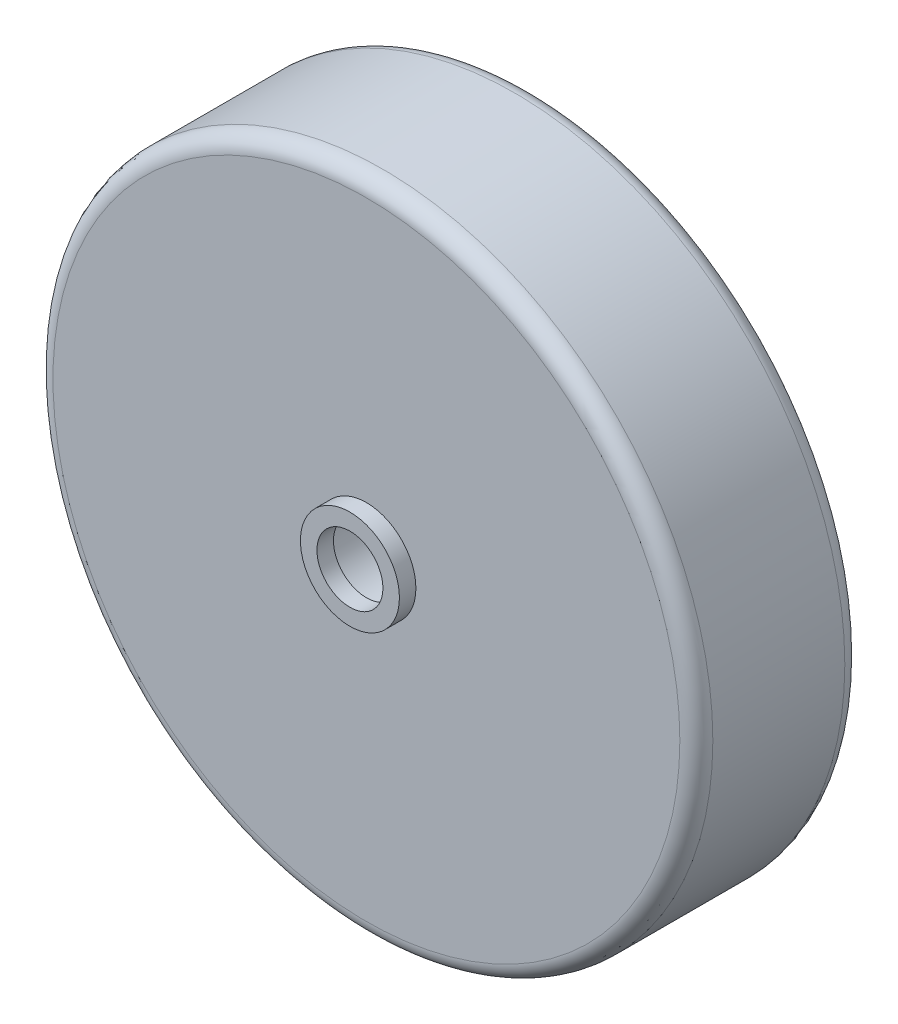
from build123d import *

# Parameters (mm, degrees)
SKETCH1_R           = 100
SKETCH1_R_2         = 15
BOSS_EXTRUDE1_DEPTH = 50
FILLET1_R           = 5
SKETCH1_5_R         = 15
SKETCH1_5_R_2       = 10
BOSS_EXTRUDE2_DEPTH = 5
BOSS_EXTRUDE3_START = 50
SKETCH1_6_R         = 15
SKETCH1_6_R_2       = 10
BOSS_EXTRUDE3_DEPTH = 5


with BuildPart() as part:
    # Sketch1 → Boss-Extrude1 (new body)
    with BuildSketch(Plane.XY):
        Circle(SKETCH1_R)
        Circle(SKETCH1_R_2, mode=Mode.SUBTRACT)
    extrude(amount=BOSS_EXTRUDE1_DEPTH)

    # Fillet1
    fillet1_edges = [part.edges().sort_by_distance(p)[0] for p in [
        (-100, 0, 50),
        (-100, 0, 0),
    ]]
    fillet(fillet1_edges, radius=FILLET1_R)


with BuildPart() as body_2:
    # Sketch1<5> → Boss-Extrude2 (new body)
    with BuildSketch(Plane.XY):
        Circle(SKETCH1_5_R)
        Circle(SKETCH1_5_R_2, mode=Mode.SUBTRACT)
    extrude(amount=-BOSS_EXTRUDE2_DEPTH)


with BuildPart() as body_3:
    # Sketch1<6> → Boss-Extrude3 (new body)
    with BuildSketch(Plane.XY.offset(BOSS_EXTRUDE3_START)):
        Circle(SKETCH1_6_R)
        Circle(SKETCH1_6_R_2, mode=Mode.SUBTRACT)
    extrude(amount=BOSS_EXTRUDE3_DEPTH)


solid = Compound([part.part, body_2.part, body_3.part])
